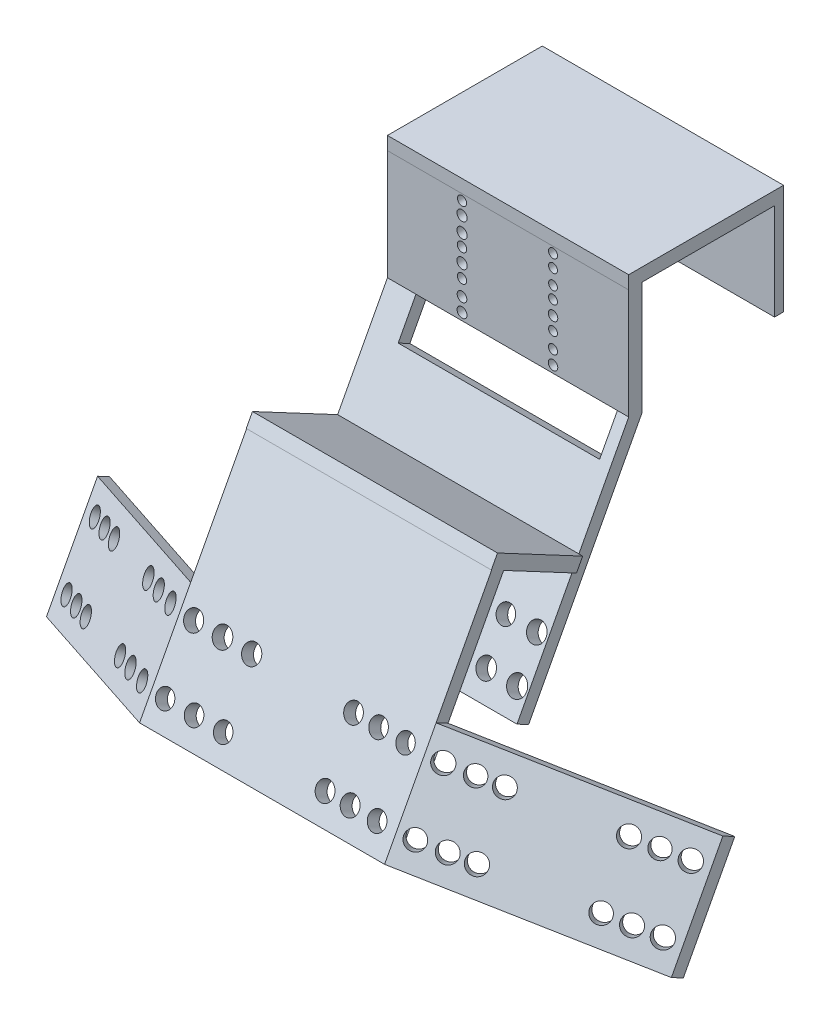
from build123d import *

# Parameters (mm, degrees)
ESQUISSE1_W              = 55
ESQUISSE1_H              = 25.8492517
BOSS_EXTRU_1_DEPTH       = 3
ESQUISSE2_W              = 55
ESQUISSE2_H              = 55
BOSS_EXTRU_2_DEPTH       = 3
ESQUISSE16_W             = 55
ESQUISSE16_H             = 35.307094403
BOSS_EXTRU_15_DEPTH      = 3
ESQUISSE21_W             = 55.864477712
ESQUISSE21_H             = 22
BOSS_EXTRU_17_DEPTH      = 3
ESQUISSE25_W             = 45.917413834
ESQUISSE25_H             = 9.073108025
ENL_V_MAT_EXTRU_1_DEPTH  = 16
ESQUISSE47_R             = 2.120066756
ESQUISSE47_R_2           = 2.01596571
ESQUISSE47_R_3           = 2.244345519
ESQUISSE47_R_4           = 2.02540016
ESQUISSE47_R_5           = 2.010644068
ESQUISSE47_R_6           = 2.176147474
ESQUISSE47_R_7           = 2.060395533
ESQUISSE47_R_8           = 2.052845226
ESQUISSE47_R_9           = 2.182892446
ESQUISSE47_R_10          = 2.12193272
ESQUISSE47_R_11          = 2.014290263
ESQUISSE47_R_12          = 2.111984436
ESQUISSE47_R_13          = 2.182234672
ESQUISSE47_R_14          = 2.190756806
ESQUISSE47_R_15          = 2.016497371
ESQUISSE47_R_16          = 2.031227867
ENL_V_MAT_EXTRU_14_DEPTH = 10
ESQUISSE48_W             = 55
ESQUISSE48_H             = 2.047939772
BOSS_EXTRU_21_DEPTH      = 22
BOSS_EXTRU_22_DEPTH      = 55
ESQUISSE64_W             = 55.864477712
ESQUISSE64_H             = 3.08527242
BOSS_EXTRU_24_DEPTH      = 55
ESQUISSE66_W             = 50
ESQUISSE66_H             = 30
ENL_V_MAT_EXTRU_15_DEPTH = 55
ESQUISSE67_W             = 50
ESQUISSE67_H             = 30
ENL_V_MAT_EXTRU_16_DEPTH = 55
ESQUISSE68_W             = 100
ESQUISSE68_H             = 30.001418291
ENL_V_MAT_EXTRU_22_DEPTH = 32
ESQUISSE45_R             = 2.072584987
ESQUISSE45_R_2           = 2.129952434
ESQUISSE45_R_3           = 2.088465689
ESQUISSE45_R_4           = 2.036838972
ESQUISSE45_R_5           = 2.024994803
ESQUISSE45_R_6           = 2.007405414
ESQUISSE45_R_7           = 2.002275891
ESQUISSE45_R_8           = 2.025845158
ESQUISSE45_R_9           = 2.017446006
ESQUISSE45_R_10          = 2.052050958
ESQUISSE45_R_11          = 2.059285869
ESQUISSE45_R_12          = 2.033020737
ENL_V_MAT_EXTRU_28_DEPTH = 42
ESQUISSE72_R             = 2.072137593
ESQUISSE72_R_2           = 2.007861392
ESQUISSE72_R_3           = 2.03970077
ESQUISSE72_R_4           = 2.088618869
ESQUISSE72_R_5           = 2.000468847
ESQUISSE72_R_6           = 2.061409389
ESQUISSE72_R_7           = 2.02667929
ESQUISSE72_R_8           = 2.04843604
ESQUISSE72_R_9           = 2.074054299
ESQUISSE72_R_10          = 2.023700844
ESQUISSE72_R_11          = 2.053600715
ESQUISSE72_R_12          = 2.078233609
ENL_V_MAT_EXTRU_29_DEPTH = 42
ESQUISSE73_R             = 1.997140622
ESQUISSE73_R_2           = 2.003658189
ESQUISSE73_R_3           = 2.038687461
ESQUISSE73_R_4           = 2.033043541
ESQUISSE73_R_5           = 2.012281279
ESQUISSE73_R_6           = 2.065321284
ESQUISSE73_R_7           = 2.012249491
ESQUISSE73_R_8           = 2.046395545
ESQUISSE73_R_9           = 2.036581145
ESQUISSE73_R_10          = 2.010232233
ESQUISSE73_R_11          = 2.04955944
ESQUISSE73_R_12          = 2.030790336
ENL_V_MAT_EXTRU_30_DEPTH = 42
ESQUISSE74_R             = 1.047251776
ESQUISSE74_R_2           = 1.127779332
ESQUISSE74_R_3           = 1.159182696
ESQUISSE74_R_4           = 1.169548894
ESQUISSE74_R_5           = 1.101975448
ESQUISSE74_R_6           = 1.067639179
ESQUISSE74_R_7           = 1.07627009
ESQUISSE74_R_8           = 1.178980139
ESQUISSE74_R_9           = 1.023763041
ESQUISSE74_R_10          = 1.016269293
ESQUISSE74_R_11          = 1.00547114
ESQUISSE74_R_12          = 1.007794799
ESQUISSE74_R_13          = 1.085320524
ESQUISSE74_R_14          = 1.0065678
ESQUISSE74_R_15          = 1.032429662
ESQUISSE74_R_16          = 1.08540019
ENL_V_MAT_EXTRU_31_DEPTH = 25
ESQUISSE75_W             = 54.768770912
ESQUISSE75_H             = 30.171654406
ENL_V_MAT_EXTRU_32_DEPTH = 33


with BuildPart() as part:
    # Esquisse1 → Boss.-Extru.1 (new body)
    with BuildSketch(Plane.XY):
        with Locations((-24.922022416, 17.183877551)):
            Rectangle(ESQUISSE1_W, ESQUISSE1_H)
    extrude(amount=BOSS_EXTRU_1_DEPTH)

    # Esquisse2 → Boss.-Extru.2 (add)
    with BuildSketch(Plane(origin=(0, 0.938754188, 1.765539845), x_dir=(1, 0, 0), z_dir=(0, -0.46947156278588564, -0.8829475928589298))):
        with Locations((-24.922022416, 23.739303964)):
            Rectangle(ESQUISSE2_W, ESQUISSE2_H)
    extrude(amount=-BOSS_EXTRU_2_DEPTH)

    # Esquisse16 → Boss.-Extru.15 (add)
    with BuildSketch(Plane(origin=(0, 30.108503401, 0), x_dir=(1, 0, 0), z_dir=(0, 1, 0))):
        with Locations((-24.922022416, 14.648815145)):
            Rectangle(ESQUISSE16_W, ESQUISSE16_H)
    extrude(amount=BOSS_EXTRU_15_DEPTH)

    # Esquisse21 → Boss.-Extru.17 (add)
    with BuildSketch(Plane(origin=(0, -18.690754637, 9.938050526), x_dir=(1, 0, 0), z_dir=(0, -0.8829475928589298, 0.46947156278588564))):
        with Locations((-24.48978356, 15.999597552)):
            Rectangle(ESQUISSE21_W, ESQUISSE21_H)
    extrude(amount=BOSS_EXTRU_17_DEPTH)

    # Esquisse25 → Enlèv. mat.-Extru.1 (cut)
    with BuildSketch(Plane(origin=(0, 2.347168876, 4.414382624), x_dir=(1, 0, 0), z_dir=(0, 0.4694715627858856, 0.8829475928589298))):
        with Locations((-22.958706917, -1.086791367)):
            Rectangle(ESQUISSE25_W, ESQUISSE25_H)
    extrude(amount=-ENL_V_MAT_EXTRU_1_DEPTH, mode=Mode.SUBTRACT)

    # Esquisse47 → Enlèv. mat.-Extru.14 (cut)
    with BuildSketch(Plane(origin=(0, 0.938754188, 1.765539845), x_dir=(1, 0, 0), z_dir=(0, -0.46947156278588564, -0.8829475928589298))):
        with Locations(Location((0, 36.12516671, 0), (0, 0, 270))):
            Circle(ESQUISSE47_R)
        with Locations(Location((-7.05571799, 36.12516671, 0), (0, 0, 270))):
            Circle(ESQUISSE47_R_2)
        with Locations(Location((-15.567816054, 36.12516671, 0), (0, 0, 270))):
            Circle(ESQUISSE47_R_3)
        with Locations(Location((-23.237724596, 36.12516671, 0), (0, 0, 270))):
            Circle(ESQUISSE47_R_4)
        with Locations(Location((-29.414082146, 36.12516671, 0), (0, 0, 270))):
            Circle(ESQUISSE47_R_5)
        with Locations(Location((-36.005921867, 36.12516671, 0), (0, 0, 270))):
            Circle(ESQUISSE47_R_6)
        with Locations(Location((-42.586536409, 36.12516671, 0), (0, 0, 270))):
            Circle(ESQUISSE47_R_7)
        with Locations(Location((-49.178376131, 36.12516671, 0), (0, 0, 270))):
            Circle(ESQUISSE47_R_8)
        with Locations(Location((0, 45.660058923, 0), (0, 0, 270))):
            Circle(ESQUISSE47_R_9)
        with Locations(Location((-7.05571799, 45.660058923, 0), (0, 0, 270))):
            Circle(ESQUISSE47_R_10)
        with Locations(Location((-15.567816054, 45.660058923, 0), (0, 0, 270))):
            Circle(ESQUISSE47_R_11)
        with Locations(Location((-23.237724596, 45.660058923, 0), (0, 0, 270))):
            Circle(ESQUISSE47_R_12)
        with Locations(Location((-29.414082146, 45.660058923, 0), (0, 0, 270))):
            Circle(ESQUISSE47_R_13)
        with Locations(Location((-36.005921867, 45.660058923, 0), (0, 0, 270))):
            Circle(ESQUISSE47_R_14)
        with Locations(Location((-42.586536409, 45.660058923, 0), (0, 0, 270))):
            Circle(ESQUISSE47_R_15)
        with Locations(Location((-49.178376131, 45.660058923, 0), (0, 0, 270))):
            Circle(ESQUISSE47_R_16)
    extrude(amount=-ENL_V_MAT_EXTRU_14_DEPTH, mode=Mode.SUBTRACT)

    # Esquisse48 → Boss.-Extru.21 (add)
    with BuildSketch(Plane(origin=(0, 30.108503401, 0), x_dir=(1, 0, 0), z_dir=(0, 1, 0))):
        with Locations((-24.922022416, 31.27839246)):
            Rectangle(ESQUISSE48_W, ESQUISSE48_H)
    extrude(amount=-BOSS_EXTRU_21_DEPTH)

    # Esquisse63 → Boss.-Extru.22 (add)
    with BuildSketch(Plane(origin=(0, -18.690754637, 9.938050526), x_dir=(1, 0, 0), z_dir=(0, -0.8829475928589298, 0.46947156278588564))):
        Polygon((-52.422022416, 23.81673594), (-52.422022416, 26.90200836), (-95.723292605, 1.90200836), (-95.723292605, -1.18326406), align=None)
        Polygon((3.442455296, 26.90200836), (3.442455296, 23.81673594), (46.743725485, -1.18326406), (46.743725485, 1.90200836), align=None)
    extrude(amount=BOSS_EXTRU_22_DEPTH)

    # Esquisse64 → Boss.-Extru.24 (add)
    with BuildSketch(Plane(origin=(0, -18.690754637, 9.938050526), x_dir=(1, 0, 0), z_dir=(0, -0.8829475928589298, 0.46947156278588564))):
        with Locations((-24.48978356, 25.35937215)):
            Rectangle(ESQUISSE64_W, ESQUISSE64_H)
    extrude(amount=BOSS_EXTRU_24_DEPTH)

    # Esquisse66 → Enlèv. mat.-Extru.15 (cut)
    with BuildSketch(Plane(origin=(11.173563003, 9.085767107, 17.087842656), x_dir=(-0.866025403784438, 0.23473578139294327, 0.44147379642946577), z_dir=(-0.5000000000000011, -0.40657429972695774, -0.7646550456261523))):
        with Locations((-16.072885768, -36.168588927)):
            Rectangle(ESQUISSE66_W, ESQUISSE66_H)
    extrude(amount=-ENL_V_MAT_EXTRU_15_DEPTH, mode=Mode.SUBTRACT)

    # Esquisse67 → Enlèv. mat.-Extru.16 (cut)
    with BuildSketch(Plane(origin=(-23.418454783, 19.042683708, 35.814079222), x_dir=(-0.8660254037844415, -0.23473578139294055, -0.4414737964294606), z_dir=(0.4999999999999951, -0.40657429972695935, -0.764655045626155))):
        with Locations((58.49043516, -36.168588927)):
            Rectangle(ESQUISSE67_W, ESQUISSE67_H)
    extrude(amount=-ENL_V_MAT_EXTRU_16_DEPTH, mode=Mode.SUBTRACT)

    # Esquisse68 → Enlèv. mat.-Extru.22 (cut)
    with BuildSketch(Plane(origin=(0, 12.675543257, 23.839229667), x_dir=(1, 0, 0), z_dir=(0, 0.4694715627858856, 0.8829475928589298))):
        with Locations((53.442455296, -36.169298072)):
            Rectangle(ESQUISSE68_W, ESQUISSE68_H)
    extrude(amount=-ENL_V_MAT_EXTRU_22_DEPTH, mode=Mode.SUBTRACT)

    # Esquisse45 → Enlèv. mat.-Extru.28 (cut)
    with BuildSketch(Plane(origin=(0, 12.675543257, 23.839229667), x_dir=(1, 0, 0), z_dir=(0, 0.4694715627858856, 0.8829475928589298))):
        with Locations(Location((-49.257963483, -56.655996898, 0), (0, 0, 270))):
            Circle(ESQUISSE45_R)
        with Locations(Location((-42.67073788, -56.655996898, 0), (0, 0, 270))):
            Circle(ESQUISSE45_R_2)
        with Locations(Location((-36.023228551, -56.655996898, 0), (0, 0, 270))):
            Circle(ESQUISSE45_R_3)
        with Locations(Location((-12.805078282, -56.655996898, 0), (0, 0, 270))):
            Circle(ESQUISSE45_R_4)
        with Locations(Location((-7.08707352, -56.655996898, 0), (0, 0, 270))):
            Circle(ESQUISSE45_R_5)
        with Locations(Location((-0.943856829, -56.655996898, 0), (0, 0, 270))):
            Circle(ESQUISSE45_R_6)
        with Locations(Location((-49.257963483, -70.473863194, 0), (0, 0, 270))):
            Circle(ESQUISSE45_R_7)
        with Locations(Location((-42.67073788, -70.473863194, 0), (0, 0, 270))):
            Circle(ESQUISSE45_R_8)
        with Locations(Location((-36.023228551, -70.473863194, 0), (0, 0, 270))):
            Circle(ESQUISSE45_R_9)
        with Locations(Location((-12.805078282, -70.473863194, 0), (0, 0, 270))):
            Circle(ESQUISSE45_R_10)
        with Locations(Location((-7.08707352, -70.473863194, 0), (0, 0, 270))):
            Circle(ESQUISSE45_R_11)
        with Locations(Location((-0.943856829, -70.473863194, 0), (0, 0, 270))):
            Circle(ESQUISSE45_R_12)
    extrude(amount=-ENL_V_MAT_EXTRU_28_DEPTH, mode=Mode.SUBTRACT)

    # Esquisse72 → Enlèv. mat.-Extru.29 (cut)
    with BuildSketch(Plane(origin=(11.173563003, 9.085767107, 17.087842656), x_dir=(-0.866025403784438, 0.23473578139294327, 0.44147379642946577), z_dir=(-0.5000000000000011, -0.40657429972695774, -0.7646550456261523))):
        with Locations(Location((7.142703421, -56.940180445, 0), (0, 0, 345.112024396))):
            Circle(ESQUISSE72_R)
        with Locations(Location((1.498907497, -56.940180445, 0), (0, 0, 345.112024396))):
            Circle(ESQUISSE72_R_2)
        with Locations(Location((-3.598006303, -56.940180445, 0), (0, 0, 345.112024396))):
            Circle(ESQUISSE72_R_3)
        with Locations(Location((-36.014117497, -56.940180445, 0), (0, 0, 345.112024396))):
            Circle(ESQUISSE72_R_4)
        with Locations(Location((-30.639447259, -56.940180445, 0), (0, 0, 345.112024396))):
            Circle(ESQUISSE72_R_5)
        with Locations(Location((-25.2467409, -56.940180445, 0), (0, 0, 345.112024396))):
            Circle(ESQUISSE72_R_6)
        with Locations(Location((7.142703421, -70.507624437, 0), (0, 0, 345.112024396))):
            Circle(ESQUISSE72_R_7)
        with Locations(Location((1.498907497, -70.507624437, 0), (0, 0, 345.112024396))):
            Circle(ESQUISSE72_R_8)
        with Locations(Location((-3.598006303, -70.507624437, 0), (0, 0, 345.112024396))):
            Circle(ESQUISSE72_R_9)
        with Locations(Location((-25.2467409, -70.507624437, 0), (0, 0, 345.112024396))):
            Circle(ESQUISSE72_R_10)
        with Locations(Location((-30.639447259, -70.507624437, 0), (0, 0, 345.112024396))):
            Circle(ESQUISSE72_R_11)
        with Locations(Location((-36.014117497, -70.507624437, 0), (0, 0, 345.112024396))):
            Circle(ESQUISSE72_R_12)
    extrude(amount=-ENL_V_MAT_EXTRU_29_DEPTH, mode=Mode.SUBTRACT)

    # Esquisse73 → Enlèv. mat.-Extru.30 (cut)
    with BuildSketch(Plane(origin=(-23.418454783, 19.042683708, 35.814079222), x_dir=(-0.8660254037844415, -0.23473578139294055, -0.4414737964294606), z_dir=(0.4999999999999951, -0.40657429972695935, -0.764655045626155))):
        with Locations(Location((77.369321824, -56.829553417, 0), (0, 0, 14.887975604))):
            Circle(ESQUISSE73_R)
        with Locations(Location((72.151321582, -56.829553417, 0), (0, 0, 14.887975604))):
            Circle(ESQUISSE73_R_2)
        with Locations(Location((67.02759154, -56.829553417, 0), (0, 0, 14.887975604))):
            Circle(ESQUISSE73_R_3)
        with Locations(Location((36.751445091, -56.829553417, 0), (0, 0, 14.887975604))):
            Circle(ESQUISSE73_R_4)
        with Locations(Location((43.026680895, -56.829553417, 0), (0, 0, 14.887975604))):
            Circle(ESQUISSE73_R_5)
        with Locations(Location((48.613475105, -56.829553417, 0), (0, 0, 14.887975604))):
            Circle(ESQUISSE73_R_6)
        with Locations(Location((77.369321824, -70.560882672, 0), (0, 0, 14.887975604))):
            Circle(ESQUISSE73_R_7)
        with Locations(Location((72.151321582, -70.560882672, 0), (0, 0, 14.887975604))):
            Circle(ESQUISSE73_R_8)
        with Locations(Location((67.02759154, -70.560882672, 0), (0, 0, 14.887975604))):
            Circle(ESQUISSE73_R_9)
        with Locations(Location((48.613475105, -70.560882672, 0), (0, 0, 14.887975604))):
            Circle(ESQUISSE73_R_10)
        with Locations(Location((43.026680895, -70.560882672, 0), (0, 0, 14.887975604))):
            Circle(ESQUISSE73_R_11)
        with Locations(Location((36.751445091, -70.560882672, 0), (0, 0, 14.887975604))):
            Circle(ESQUISSE73_R_12)
    extrude(amount=-ENL_V_MAT_EXTRU_30_DEPTH, mode=Mode.SUBTRACT)

    # Esquisse74 → Enlèv. mat.-Extru.31 (cut)
    with BuildSketch(Plane.XY):
        with Locations((-35.422022416, 28.716268076)):
            Circle(ESQUISSE74_R)
        with Locations((-35.422022416, 6.661493679)):
            Circle(ESQUISSE74_R_2)
        with Locations((-35.422022416, 25.798513221)):
            Circle(ESQUISSE74_R_3)
        with Locations((-35.422022416, 22.376351135)):
            Circle(ESQUISSE74_R_4)
        with Locations((-35.422022416, 9.7639847)):
            Circle(ESQUISSE74_R_5)
        with Locations((-35.422022416, 13.364994227)):
            Circle(ESQUISSE74_R_6)
        with Locations((-35.422022416, 19.596974453)):
            Circle(ESQUISSE74_R_7)
        with Locations((-35.422022416, 16.384672467)):
            Circle(ESQUISSE74_R_8)
        with Locations((-14.675882221, 28.716268076)):
            Circle(ESQUISSE74_R_9)
        with Locations((-14.675882221, 25.798513221)):
            Circle(ESQUISSE74_R_10)
        with Locations((-14.675882221, 22.376351135)):
            Circle(ESQUISSE74_R_11)
        with Locations((-14.675882221, 19.596974453)):
            Circle(ESQUISSE74_R_12)
        with Locations((-14.675882221, 16.384672467)):
            Circle(ESQUISSE74_R_13)
        with Locations((-14.675882221, 13.364994227)):
            Circle(ESQUISSE74_R_14)
        with Locations((-14.675882221, 9.7639847)):
            Circle(ESQUISSE74_R_15)
        with Locations((-14.675882221, 6.661493679)):
            Circle(ESQUISSE74_R_16)
    extrude(amount=ENL_V_MAT_EXTRU_31_DEPTH, mode=Mode.SUBTRACT)

    # Esquisse75 → Enlèv. mat.-Extru.32 (cut)
    with BuildSketch(Plane(origin=(0, 12.675543257, 23.839229667), x_dir=(1, 0, 0), z_dir=(0, 0.4694715627858856, 0.8829475928589298))):
        with Locations((-79.806407872, -36.25441613)):
            Rectangle(ESQUISSE75_W, ESQUISSE75_H)
    extrude(amount=-ENL_V_MAT_EXTRU_32_DEPTH, mode=Mode.SUBTRACT)


solid = part.part
